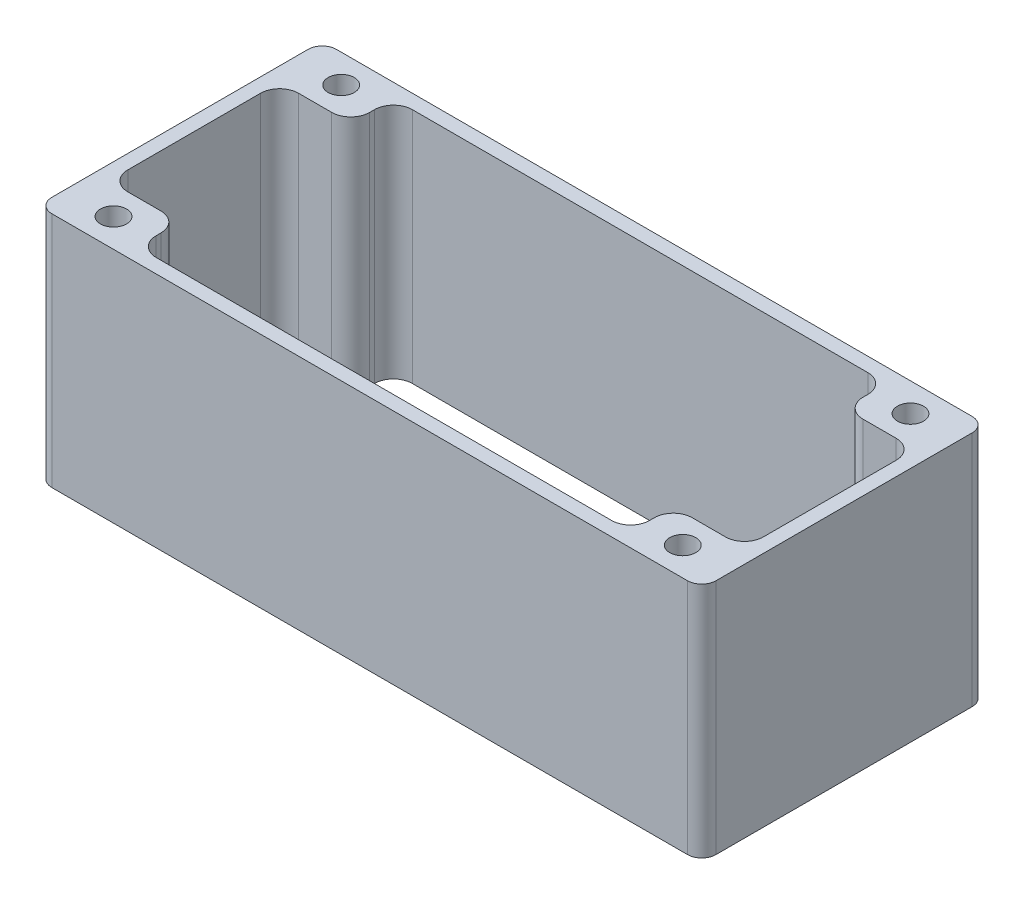
from build123d import *

# Parameters (mm, degrees)
SKETCH1_R           = 2.75
SKETCH1_W           = 130
SKETCH1_H           = 38
BOSS_EXTRUDE1_DEPTH = 10
SKETCH1_2_W         = 130
SKETCH1_2_H         = 38
BOSS_EXTRUDE2_DEPTH = 10
SKETCH14_W          = 15
SKETCH14_H          = 36
SKETCH14_W_2        = 104
SKETCH14_H_2        = 9
CUT_EXTRUDE2_DEPTH  = 77.811457479
FILLET2_R           = 4
SKETCH15_R          = 2.75
BOSS_EXTRUDE3_DEPTH = 40


with BuildPart() as part:
    # Sketch1 → Boss-Extrude1 (new body)
    with BuildSketch(Plane(origin=(0, 0, 0), x_dir=(1, 0, 0), z_dir=(0, 1, 0))):
        with BuildLine():
            Line((67, 30), (-67, 30))
            ThreePointArc((-67, 30), (-69.121320344, 29.121320344), (-70, 27))
            Line((-70, 27), (-70, -27))
            ThreePointArc((-70, -27), (-69.121320344, -29.121320344), (-67, -30))
            Line((-67, -30), (67, -30))
            ThreePointArc((67, -30), (69.121320344, -29.121320344), (70, -27))
            Line((70, -27), (70, 27))
            ThreePointArc((70, 27), (69.121320344, 29.121320344), (67, 30))
        make_face()
        with Locations(Location((-60, 24, 0), (0, 0, 270))):
            Circle(SKETCH1_R, mode=Mode.SUBTRACT)
        with Locations(Location((-60, -24, 0), (0, 0, 270))):
            Circle(SKETCH1_R, mode=Mode.SUBTRACT)
        with Locations(Location((60, -24, 0), (0, 0, 270))):
            Circle(SKETCH1_R, mode=Mode.SUBTRACT)
        with Locations(Location((60, 24, 0), (0, 0, 270))):
            Circle(SKETCH1_R, mode=Mode.SUBTRACT)
        Rectangle(SKETCH1_W, SKETCH1_H, mode=Mode.SUBTRACT)
    extrude(amount=BOSS_EXTRUDE1_DEPTH)

    # Sketch1<2> → Boss-Extrude2 (add)
    with BuildSketch(Plane(origin=(0, 0, 0), x_dir=(1, 0, 0), z_dir=(0, 1, 0))):
        Rectangle(SKETCH1_2_W, SKETCH1_2_H)
    extrude(amount=BOSS_EXTRUDE2_DEPTH)

    # Sketch14 → Cut-Extrude2 (cut, through all)
    with BuildSketch(Plane(origin=(0, 10, 0), x_dir=(1, 0, 0), z_dir=(0, 1, 0))):
        with Locations((-59.5, 0)):
            Rectangle(SKETCH14_W, SKETCH14_H)
        Rectangle(SKETCH14_W_2, SKETCH14_H)
        with Locations((0, 22.5)):
            Rectangle(SKETCH14_W_2, SKETCH14_H_2)
        with Locations((59.5, 0)):
            Rectangle(SKETCH14_W, SKETCH14_H)
        with Locations((0, -22.5)):
            Rectangle(SKETCH14_W_2, SKETCH14_H_2)
    extrude(amount=-CUT_EXTRUDE2_DEPTH, mode=Mode.SUBTRACT)

    # Fillet2
    fillet2_edges = [part.edges().sort_by_distance(p)[0] for p in [
        (-67, 5, 18),
        (-67, 5, -18),
        (-52, 5, -18),
        (-52, 5, -27),
        (52, 5, -27),
        (52, 5, -18),
        (67, 5, -18),
        (67, 5, 18),
        (52, 5, 18),
        (52, 5, 27),
        (-52, 5, 27),
        (-52, 5, 18),
    ]]
    fillet(fillet2_edges, radius=FILLET2_R)

    # Sketch15 → Boss-Extrude3 (add)
    with BuildSketch(Plane(origin=(0, 10, 0), x_dir=(1, 0, 0), z_dir=(0, 1, 0))):
        with BuildLine():
            Line((67, 30), (-67, 30))
            ThreePointArc((-67, 30), (-69.121320344, 29.121320344), (-70, 27))
            Line((-70, 27), (-70, -27))
            ThreePointArc((-70, -27), (-69.121320344, -29.121320344), (-67, -30))
            Line((-67, -30), (67, -30))
            ThreePointArc((67, -30), (69.121320344, -29.121320344), (70, -27))
            Line((70, -27), (70, 27))
            ThreePointArc((70, 27), (69.121320344, 29.121320344), (67, 30))
        make_face()
        with Locations(Location((-60, 24, 0), (0, 0, 270))):
            Circle(SKETCH15_R, mode=Mode.SUBTRACT)
        with Locations(Location((-60, -24, 0), (0, 0, 270))):
            Circle(SKETCH15_R, mode=Mode.SUBTRACT)
        with Locations(Location((60, -24, 0), (0, 0, 270))):
            Circle(SKETCH15_R, mode=Mode.SUBTRACT)
        with Locations(Location((60, 24, 0), (0, 0, 270))):
            Circle(SKETCH15_R, mode=Mode.SUBTRACT)
        with BuildLine():
            Line((56, -18), (63, -18))
            ThreePointArc((63, -18), (65.828427125, -16.828427125), (67, -14))
            Line((67, -14), (67, 14))
            ThreePointArc((67, 14), (65.828427125, 16.828427125), (63, 18))
            Line((63, 18), (56, 18))
            ThreePointArc((56, 18), (53.171572875, 19.171572875), (52, 22))
            Line((52, 22), (52, 23))
            ThreePointArc((52, 23), (50.828427125, 25.828427125), (48, 27))
            Line((48, 27), (-48, 27))
            ThreePointArc((-48, 27), (-50.828427125, 25.828427125), (-52, 23))
            Line((-52, 23), (-52, 22))
            ThreePointArc((-52, 22), (-53.171572875, 19.171572875), (-56, 18))
            Line((-56, 18), (-63, 18))
            ThreePointArc((-63, 18), (-65.828427125, 16.828427125), (-67, 14))
            Line((-67, 14), (-67, -14))
            ThreePointArc((-67, -14), (-65.828427125, -16.828427125), (-63, -18))
            Line((-63, -18), (-56, -18))
            ThreePointArc((-56, -18), (-53.171572875, -19.171572875), (-52, -22))
            Line((-52, -22), (-52, -23))
            ThreePointArc((-52, -23), (-50.828427125, -25.828427125), (-48, -27))
            Line((-48, -27), (48, -27))
            ThreePointArc((48, -27), (50.828427125, -25.828427125), (52, -23))
            Line((52, -23), (52, -22))
            ThreePointArc((52, -22), (53.171572875, -19.171572875), (56, -18))
        make_face(mode=Mode.SUBTRACT)
    extrude(amount=BOSS_EXTRUDE3_DEPTH)


solid = part.part
